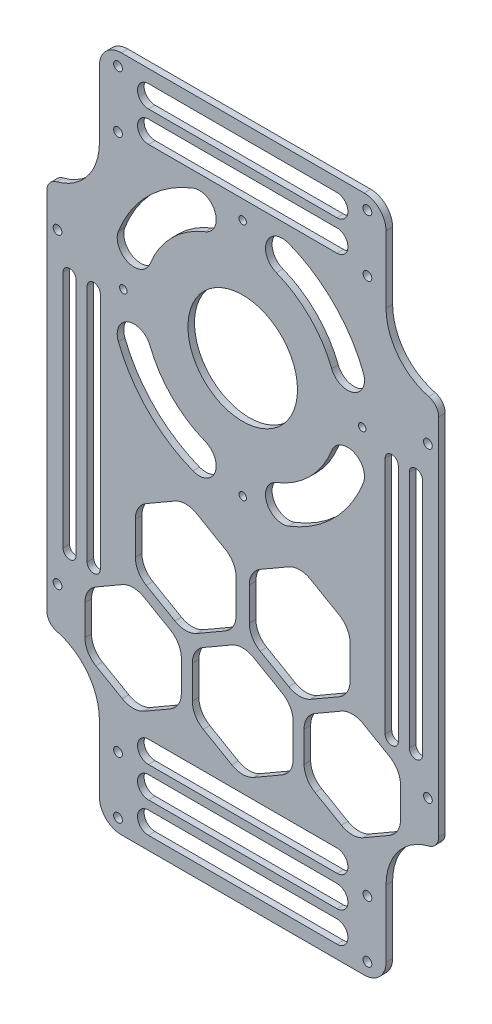
from build123d import *

# Parameters (mm, degrees)
SKETCH_1_W          = 150.8
SKETCH_1_H          = 337.05
SKETCH_1_W_2        = 118.8
SKETCH_1_H_2        = 305.05
SKETCH_1_R          = 2
EXTRUDE_1_DEPTH     = 3
SKETCH_2_W          = 14
SKETCH_2_H          = 178
EXTRUDE_2_DEPTH     = 3
SKETCH_3_R          = 1.7
CUT_EXTRUDE_1_DEPTH = 67
SKETCH_4_R          = 2
CUT_EXTRUDE_2_DEPTH = 67
SKETCH_5_W          = 130.8
SKETCH_5_H          = 14
SKETCH_5_W_2        = 10
SKETCH_5_H_2        = 65.525
CUT_EXTRUDE_3_DEPTH = 67
FILLET_1_R          = 10
FILLET_2_R          = 6
FILLET_4_R          = 26
CUT_EXTRUDE_4_DEPTH = 10
CUT_EXTRUDE_5_DEPTH = 10
SKETCH_10_R         = 25
CUT_EXTRUDE_8_DEPTH = 10
CUT_EXTRUDE_9_DEPTH = 10


with BuildPart() as part:
    # 草图1 → 凸台-拉伸1 (new body)
    # profile 1 of 2: a face of its own
    with BuildSketch(Plane.XY):
        with Locations((59.4, -152.525)):
            Rectangle(SKETCH_1_W, SKETCH_1_H)
        with Locations((59.4, -152.525)):
            Rectangle(SKETCH_1_W_2, SKETCH_1_H_2, mode=Mode.SUBTRACT)
    # profile 2 of 2: a face of its own
    with BuildSketch(Plane.XY):
        with Locations((59.4, -152.525)):
            Rectangle(SKETCH_1_W_2, SKETCH_1_H_2)
        with Locations((116.3, -30.025)):
            Circle(SKETCH_1_R, mode=Mode.SUBTRACT)
        with Locations((116.3, -301.025)):
            Circle(SKETCH_1_R, mode=Mode.SUBTRACT)
        with Locations((2.5, -301.025)):
            Circle(SKETCH_1_R, mode=Mode.SUBTRACT)
        with Locations((2.5, -275.025)):
            Circle(SKETCH_1_R, mode=Mode.SUBTRACT)
        with Locations((2.5, -30.025)):
            Circle(SKETCH_1_R, mode=Mode.SUBTRACT)
        with Locations((2.5, -4.025)):
            Circle(SKETCH_1_R, mode=Mode.SUBTRACT)
        with Locations((116.3, -275.025)):
            Circle(SKETCH_1_R, mode=Mode.SUBTRACT)
        with Locations((116.3, -4.025)):
            Circle(SKETCH_1_R, mode=Mode.SUBTRACT)
    extrude(amount=EXTRUDE_1_DEPTH)

    # 草图2 → 凸台-拉伸2 (add)
    with BuildSketch(Plane.XY.offset(3)):
        with Locations((-23, -152.525)):
            Rectangle(SKETCH_2_W, SKETCH_2_H)
        with Locations((141.8, -152.525)):
            Rectangle(SKETCH_2_W, SKETCH_2_H)
    extrude(amount=-EXTRUDE_2_DEPTH)

    # 草图3 → 切除-拉伸1 (cut)
    with BuildSketch(Plane.XY.offset(3)):
        with Locations((4.9, -91)):
            Circle(SKETCH_3_R)
        with Locations((59.4, -145.5)):
            Circle(SKETCH_3_R)
        with Locations((113.9, -91)):
            Circle(SKETCH_3_R)
        with Locations((59.4, -36.5)):
            Circle(SKETCH_3_R)
    extrude(amount=-CUT_EXTRUDE_1_DEPTH, mode=Mode.SUBTRACT)

    # 草图4 → 切除-拉伸2 (cut)
    with BuildSketch(Plane.XY.offset(3)):
        with Locations((143.9, -82.525)):
            Circle(SKETCH_4_R)
        with Locations((-25.1, -82.525)):
            Circle(SKETCH_4_R)
        with Locations((143.9, -222.525)):
            Circle(SKETCH_4_R)
        with Locations((-25.1, -222.525)):
            Circle(SKETCH_4_R)
    extrude(amount=-CUT_EXTRUDE_2_DEPTH, mode=Mode.SUBTRACT)

    # 草图5 → 切除-拉伸3 (cut)
    with BuildSketch(Plane.XY.offset(3)):
        with Locations((59.4, 9)):
            Rectangle(SKETCH_5_W, SKETCH_5_H)
        with Locations((-11, 9)):
            Rectangle(SKETCH_5_W_2, SKETCH_5_H)
        with Locations((-11, -30.7625)):
            Rectangle(SKETCH_5_W_2, SKETCH_5_H_2)
        with Locations((129.8, 9)):
            Rectangle(SKETCH_5_W_2, SKETCH_5_H)
        with Locations((129.8, -30.7625)):
            Rectangle(SKETCH_5_W_2, SKETCH_5_H_2)
        with Locations((129.8, -274.2875)):
            Rectangle(SKETCH_5_W_2, SKETCH_5_H_2)
        with Locations((129.8, -314.05)):
            Rectangle(SKETCH_5_W_2, SKETCH_5_H)
        with Locations((59.4, -314.05)):
            Rectangle(SKETCH_5_W, SKETCH_5_H)
        with Locations((-11, -314.05)):
            Rectangle(SKETCH_5_W_2, SKETCH_5_H)
        with Locations((-11, -274.2875)):
            Rectangle(SKETCH_5_W_2, SKETCH_5_H_2)
    extrude(amount=-CUT_EXTRUDE_3_DEPTH, mode=Mode.SUBTRACT)

    # 圆角1
    fillet_1_edges = [part.edges().sort_by_distance(p)[0] for p in [
        (124.8, 2, 1.5),
        (-6, 2, 1.5),
        (124.8, -307.05, 1.5),
        (-6, -307.05, 1.5),
    ]]
    fillet(fillet_1_edges, radius=FILLET_1_R)

    # 圆角2
    fillet_2_edges = [part.edges().sort_by_distance(p)[0] for p in [
        (-30, -63.525, 1.5),
        (-30, -241.525, 1.5),
        (148.8, -63.525, 1.5),
        (148.8, -241.525, 1.5),
    ]]
    fillet(fillet_2_edges, radius=FILLET_2_R)

    # 圆角4
    fillet_4_edges = [part.edges().sort_by_distance(p)[0] for p in [
        (-6, -241.525, 1.5),
        (124.8, -241.525, 1.5),
        (-6, -63.525, 1.5),
        (124.8, -63.525, 1.5),
    ]]
    fillet(fillet_4_edges, radius=FILLET_4_R)

    # 草图6 → 切除-拉伸4 (cut)
    with BuildSketch(Plane.XY.offset(3)):
        with BuildLine():
            Line((102.4, -291.05), (16.4, -291.05))
            ThreePointArc((16.4, -291.05), (11.4, -296.05), (16.4, -301.05))
            Line((16.4, -301.05), (102.4, -301.05))
            ThreePointArc((102.4, -301.05), (107.4, -296.05), (102.4, -291.05))
        make_face()
        with BuildLine():
            Line((102.4, -277.05), (16.4, -277.05))
            ThreePointArc((16.4, -277.05), (11.4, -282.05), (16.4, -287.05))
            Line((16.4, -287.05), (102.4, -287.05))
            ThreePointArc((102.4, -287.05), (107.4, -282.05), (102.4, -277.05))
        make_face()
        with BuildLine():
            Line((102.4, -263.05), (16.4, -263.05))
            ThreePointArc((16.4, -263.05), (11.4, -268.05), (16.4, -273.05))
            Line((16.4, -273.05), (102.4, -273.05))
            ThreePointArc((102.4, -273.05), (107.4, -268.05), (102.4, -263.05))
        make_face()
        with BuildLine():
            ThreePointArc((16.4, -4), (11.4, -9), (16.4, -14))
            Line((16.4, -14), (102.4, -14))
            ThreePointArc((102.4, -14), (107.4, -9), (102.4, -4))
            Line((102.4, -4), (16.4, -4))
        make_face()
        with BuildLine():
            ThreePointArc((16.4, -18), (11.4, -23), (16.4, -28))
            Line((16.4, -28), (102.4, -28))
            ThreePointArc((102.4, -28), (107.4, -23), (102.4, -18))
            Line((102.4, -18), (16.4, -18))
        make_face()
    extrude(amount=-CUT_EXTRUDE_4_DEPTH, mode=Mode.SUBTRACT)

    # 草图8 → 切除-拉伸5 (cut)
    with BuildSketch(Plane.XY.offset(3)):
        with BuildLine():
            Line((31.4, -237.420090848), (31.4, -223.563684387))
            ThreePointArc((31.4, -223.563684387), (30.060254038, -218.563684387), (26.4, -214.903430349))
            Line((26.4, -214.903430349), (14.4, -207.975227119))
            ThreePointArc((14.4, -207.975227119), (9.4, -206.635481157), (4.4, -207.975227119))
            Line((4.4, -207.975227119), (-7.6, -214.903430349))
            ThreePointArc((-7.6, -214.903430349), (-11.260254038, -218.563684387), (-12.6, -223.563684387))
            Line((-12.6, -223.563684387), (-12.6, -237.420090848))
            ThreePointArc((-12.6, -237.420090848), (-11.260254038, -242.420090848), (-7.6, -246.080344885))
            Line((-7.6, -246.080344885), (4.4, -253.008548116))
            ThreePointArc((4.4, -253.008548116), (9.4, -254.348294078), (14.4, -253.008548116))
            Line((14.4, -253.008548116), (26.4, -246.080344885))
            ThreePointArc((26.4, -246.080344885), (30.060254038, -242.420090848), (31.4, -237.420090848))
        make_face()
        with BuildLine():
            Line((82.4, -237.997441117), (82.4, -222.986334118))
            ThreePointArc((82.4, -222.986334118), (81.060254038, -217.986334118), (77.4, -214.32608008))
            Line((77.4, -214.32608008), (64.4, -206.820526581))
            ThreePointArc((64.4, -206.820526581), (59.4, -205.480780618), (54.4, -206.820526581))
            Line((54.4, -206.820526581), (41.4, -214.32608008))
            ThreePointArc((41.4, -214.32608008), (37.739745962, -217.986334118), (36.4, -222.986334118))
            Line((36.4, -222.986334118), (36.4, -237.997441117))
            ThreePointArc((36.4, -237.997441117), (37.739745962, -242.997441117), (41.4, -246.657695155))
            Line((41.4, -246.657695155), (54.4, -254.163248654))
            ThreePointArc((54.4, -254.163248654), (59.4, -255.502994616), (64.4, -254.163248654))
            Line((64.4, -254.163248654), (77.4, -246.657695155))
            ThreePointArc((77.4, -246.657695155), (81.060254038, -242.997441117), (82.4, -237.997441117))
        make_face()
        with BuildLine():
            Line((126.4, -214.903430349), (114.4, -207.975227119))
            ThreePointArc((114.4, -207.975227119), (109.4, -206.635481157), (104.4, -207.975227119))
            Line((104.4, -207.975227119), (92.4, -214.903430349))
            ThreePointArc((92.4, -214.903430349), (88.739745962, -218.563684387), (87.4, -223.563684387))
            Line((87.4, -223.563684387), (87.4, -237.420090848))
            ThreePointArc((87.4, -237.420090848), (88.739745962, -242.420090848), (92.4, -246.080344885))
            Line((92.4, -246.080344885), (104.4, -253.008548116))
            ThreePointArc((104.4, -253.008548116), (109.4, -254.348294078), (114.4, -253.008548116))
            Line((114.4, -253.008548116), (126.4, -246.080344885))
            ThreePointArc((126.4, -246.080344885), (130.060254038, -242.420090848), (131.4, -237.420090848))
            Line((131.4, -237.420090848), (131.4, -223.563684387))
            ThreePointArc((131.4, -223.563684387), (130.060254038, -218.563684387), (126.4, -214.903430349))
        make_face()
        with BuildLine():
            Line((56.4, -194.118820658), (56.4, -179.107713659))
            ThreePointArc((56.4, -179.107713659), (55.060254038, -174.107713659), (51.4, -170.447459622))
            Line((51.4, -170.447459622), (38.4, -162.941906122))
            ThreePointArc((38.4, -162.941906122), (33.4, -161.60216016), (28.4, -162.941906122))
            Line((28.4, -162.941906122), (15.4, -170.447459622))
            ThreePointArc((15.4, -170.447459622), (11.739745962, -174.107713659), (10.4, -179.107713659))
            Line((10.4, -179.107713659), (10.4, -194.118820658))
            ThreePointArc((10.4, -194.118820658), (11.739745962, -199.118820658), (15.4, -202.779074696))
            Line((15.4, -202.779074696), (28.4, -210.284628196))
            ThreePointArc((28.4, -210.284628196), (33.4, -211.624374158), (38.4, -210.284628196))
            Line((38.4, -210.284628196), (51.4, -202.779074696))
            ThreePointArc((51.4, -202.779074696), (55.060254038, -199.118820658), (56.4, -194.118820658))
        make_face()
        with BuildLine():
            Line((108.4, -194.118820658), (108.4, -179.107713659))
            ThreePointArc((108.4, -179.107713659), (107.060254038, -174.107713659), (103.4, -170.447459622))
            Line((103.4, -170.447459622), (90.4, -162.941906122))
            ThreePointArc((90.4, -162.941906122), (85.4, -161.60216016), (80.4, -162.941906122))
            Line((80.4, -162.941906122), (67.4, -170.447459622))
            ThreePointArc((67.4, -170.447459622), (63.739745962, -174.107713659), (62.4, -179.107713659))
            Line((62.4, -179.107713659), (62.4, -194.118820658))
            ThreePointArc((62.4, -194.118820658), (63.739745962, -199.118820658), (67.4, -202.779074696))
            Line((67.4, -202.779074696), (80.4, -210.284628196))
            ThreePointArc((80.4, -210.284628196), (85.4, -211.624374158), (90.4, -210.284628196))
            Line((90.4, -210.284628196), (103.4, -202.779074696))
            ThreePointArc((103.4, -202.779074696), (107.060254038, -199.118820658), (108.4, -194.118820658))
        make_face()
        with BuildLine():
            Line((130.4, -98.025), (130.4, -207.025))
            ThreePointArc((130.4, -207.025), (127.4, -210.025), (124.4, -207.025))
            Line((124.4, -207.025), (124.4, -98.025))
            ThreePointArc((124.4, -98.025), (127.4, -95.025), (130.4, -98.025))
        make_face()
        with BuildLine():
            Line((141.4, -98.025), (141.4, -207.025))
            ThreePointArc((141.4, -207.025), (138.4, -210.025), (135.4, -207.025))
            Line((135.4, -207.025), (135.4, -98.025))
            ThreePointArc((135.4, -98.025), (138.4, -95.025), (141.4, -98.025))
        make_face()
        with BuildLine():
            Line((-11.6, -98.025), (-11.6, -207.025))
            ThreePointArc((-11.6, -207.025), (-8.6, -210.025), (-5.6, -207.025))
            Line((-5.6, -207.025), (-5.6, -98.025))
            ThreePointArc((-5.6, -98.025), (-8.6, -95.025), (-11.6, -98.025))
        make_face()
        with BuildLine():
            Line((-22.6, -98.025), (-22.6, -207.025))
            ThreePointArc((-22.6, -207.025), (-19.6, -210.025), (-16.6, -207.025))
            Line((-16.6, -207.025), (-16.6, -98.025))
            ThreePointArc((-16.6, -98.025), (-19.6, -95.025), (-22.6, -98.025))
        make_face()
    extrude(amount=-CUT_EXTRUDE_5_DEPTH, mode=Mode.SUBTRACT)

    # 草图10 → 切除-拉伸8 (cut)
    with BuildSketch(Plane.XY.offset(3)):
        with Locations((59.4, -91)):
            Circle(SKETCH_10_R)
    extrude(amount=-CUT_EXTRUDE_8_DEPTH, mode=Mode.SUBTRACT)

    # 草图9 → 切除-拉伸9 (cut)
    with BuildSketch(Plane.XY.offset(3)):
        with BuildLine():
            ThreePointArc((74.731818959, -49.54642675), (90.016251763, -59.533748237), (100.00357325, -74.818181041))
            ThreePointArc((100.00357325, -74.818181041), (110.041197897, -79.219442608), (114.442458466, -69.181817523))
            ThreePointArc((114.442458466, -69.181817523), (100.976406551, -48.573592809), (80.368181633, -35.107541204))
            ThreePointArc((80.368181633, -35.107541204), (70.330557227, -39.508802525), (74.731818959, -49.54642675))
        make_face()
        with BuildLine():
            ThreePointArc((100.00357325, -107.181818959), (90.016251698, -122.466251828), (74.731818788, -132.453573317))
            ThreePointArc((74.731818788, -132.453573317), (70.33055726, -142.491197561), (80.368181633, -146.892458796))
            ThreePointArc((80.368181633, -146.892458796), (100.976406627, -133.426407116), (114.442458544, -112.818182278))
            ThreePointArc((114.442458544, -112.818182278), (110.041197798, -102.780557353), (100.00357325, -107.181818959))
        make_face()
        with BuildLine():
            ThreePointArc((17.096426734, -74.818181081), (27.083748287, -59.533748188), (42.368181212, -49.546426683))
            ThreePointArc((42.368181212, -49.546426683), (46.76944274, -39.508802439), (36.731818367, -35.107541204))
            ThreePointArc((36.731818367, -35.107541204), (16.12359322, -48.573593038), (2.657541298, -69.181818128))
            ThreePointArc((2.657541298, -69.181818128), (7.058802385, -79.219442718), (17.096426734, -74.818181081))
        make_face()
        with BuildLine():
            ThreePointArc((42.368181212, -132.453573317), (27.083748258, -122.466251784), (17.096426705, -107.181818844))
            ThreePointArc((17.096426705, -107.181818844), (7.058802429, -102.780557264), (2.657541234, -112.818181709))
            ThreePointArc((2.657541234, -112.818181709), (16.123593115, -133.426406858), (36.731818255, -146.892458752))
            ThreePointArc((36.731818255, -146.892458752), (46.769442718, -142.491197617), (42.368181212, -132.453573317))
        make_face()
    extrude(amount=-CUT_EXTRUDE_9_DEPTH, mode=Mode.SUBTRACT)


solid = part.part
